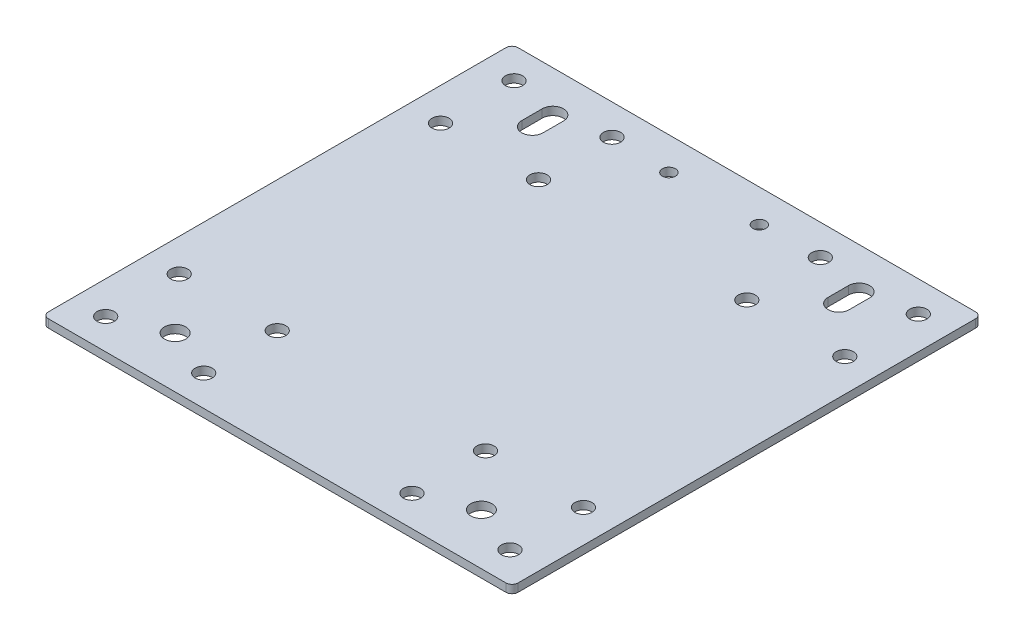
from build123d import *

# Parameters (mm, degrees)
SKETCH1_W           = 115
SKETCH1_H           = 115
SKETCH1_R           = 2.6
BOSS_EXTRUDE1_DEPTH = 2
SKETCH2_R           = 2.1
CUT_EXTRUDE1_DEPTH  = 82.341871137
SKETCH3_W           = 17.5
SKETCH3_H           = 22.5
CUT_EXTRUDE2_DEPTH  = 82.341871137
SKETCH4_R           = 1.6
CUT_EXTRUDE3_DEPTH  = 82.341871137
CUT_EXTRUDE4_DEPTH  = 82.341871137
SKETCH7_W           = 17.5
SKETCH7_H           = 22.5
BOSS_EXTRUDE2_DEPTH = 2
FILLET1_R           = 1.5


with BuildPart() as part:
    # Sketch1 → Boss-Extrude1 (new body)
    with BuildSketch(Plane(origin=(0, 0, 0), x_dir=(1, 0, 0), z_dir=(0, 1, 0))):
        Rectangle(SKETCH1_W, SKETCH1_H)
        with Locations(Location((-37.5, 45, 0), (0, 0, 270))):
            Circle(SKETCH1_R, mode=Mode.SUBTRACT)
        with Locations(Location((37.5, 45, 0), (0, 0, 90))):
            Circle(SKETCH1_R, mode=Mode.SUBTRACT)
        with Locations(Location((37.5, -45, 0), (0, 0, 270))):
            Circle(SKETCH1_R, mode=Mode.SUBTRACT)
        with Locations(Location((-37.5, -45, 0), (0, 0, 90))):
            Circle(SKETCH1_R, mode=Mode.SUBTRACT)
    extrude(amount=BOSS_EXTRUDE1_DEPTH)

    # Sketch2 → Cut-Extrude1 (cut, through all)
    with BuildSketch(Plane(origin=(0, 2, 0), x_dir=(1, 0, 0), z_dir=(0, 1, 0))):
        with Locations(Location((-49.5, -32, 0), (0, 0, 270))):
            Circle(SKETCH2_R)
        with Locations(Location((-25.5, -32, 0), (0, 0, 90))):
            Circle(SKETCH2_R)
        with Locations(Location((-25.5, -50, 0), (0, 0, 270))):
            Circle(SKETCH2_R)
        with Locations(Location((-49.5, -50, 0), (0, 0, 90))):
            Circle(SKETCH2_R)
        with Locations(Location((25.5, -50, 0), (0, 0, 90))):
            Circle(SKETCH2_R)
        with Locations(Location((49.5, -50, 0), (0, 0, 270))):
            Circle(SKETCH2_R)
        with Locations(Location((49.5, -32, 0), (0, 0, 90))):
            Circle(SKETCH2_R)
        with Locations(Location((25.5, -32, 0), (0, 0, 270))):
            Circle(SKETCH2_R)
        with Locations(Location((49.5, 50, 0), (0, 0, 90))):
            Circle(SKETCH2_R)
        with Locations(Location((49.5, 32, 0), (0, 0, 270))):
            Circle(SKETCH2_R)
        with Locations(Location((25.5, 50, 0), (0, 0, 270))):
            Circle(SKETCH2_R)
        with Locations(Location((25.5, 32, 0), (0, 0, 90))):
            Circle(SKETCH2_R)
        with Locations(Location((-25.5, 50, 0), (0, 0, 90))):
            Circle(SKETCH2_R)
        with Locations(Location((-49.5, 50, 0), (0, 0, 270))):
            Circle(SKETCH2_R)
        with Locations(Location((-49.5, 32, 0), (0, 0, 90))):
            Circle(SKETCH2_R)
        with Locations(Location((-25.5, 32, 0), (0, 0, 270))):
            Circle(SKETCH2_R)
    extrude(amount=-CUT_EXTRUDE1_DEPTH, mode=Mode.SUBTRACT)

    # Sketch3 → Cut-Extrude2 (cut, through all)
    with BuildSketch(Plane(origin=(0, 2, 0), x_dir=(1, 0, 0), z_dir=(0, 1, 0))):
        with Locations((0, -46.25)):
            Rectangle(SKETCH3_W, SKETCH3_H)
    extrude(amount=-CUT_EXTRUDE2_DEPTH, mode=Mode.SUBTRACT)

    # Sketch4 → Cut-Extrude3 (cut, through all)
    with BuildSketch(Plane(origin=(0, 2, 0), x_dir=(1, 0, 0), z_dir=(0, 1, 0))):
        with Locations(Location((-11.075, 49.5, 0), (0, 0, 270))):
            Circle(SKETCH4_R)
        with Locations(Location((11.075, 49.5, 0), (0, 0, 90))):
            Circle(SKETCH4_R)
    extrude(amount=-CUT_EXTRUDE3_DEPTH, mode=Mode.SUBTRACT)

    # Sketch6 → Cut-Extrude4 (cut, through all)
    with BuildSketch(Plane(origin=(0, 2, 0), x_dir=(1, 0, 0), z_dir=(0, 1, 0))):
        with BuildLine():
            Line((-34.9, 47.5), (-34.9, 42.5))
            ThreePointArc((-34.9, 42.5), (-37.5, 39.9), (-40.1, 42.5))
            Line((-40.1, 42.5), (-40.1, 47.5))
            ThreePointArc((-40.1, 47.5), (-37.5, 50.1), (-34.9, 47.5))
        make_face()
        with BuildLine():
            Line((34.9, 47.5), (34.9, 42.5))
            ThreePointArc((34.9, 42.5), (37.5, 39.9), (40.1, 42.5))
            Line((40.1, 42.5), (40.1, 47.5))
            ThreePointArc((40.1, 47.5), (37.5, 50.1), (34.9, 47.5))
        make_face()
    extrude(amount=-CUT_EXTRUDE4_DEPTH, mode=Mode.SUBTRACT)

    # Sketch7 → Boss-Extrude2 (add, through all)
    with BuildSketch(Plane(origin=(0, 2, 0), x_dir=(1, 0, 0), z_dir=(0, 1, 0))):
        with Locations((0, -46.25)):
            Rectangle(SKETCH7_W, SKETCH7_H)
    extrude(amount=-BOSS_EXTRUDE2_DEPTH)

    # Fillet1
    fillet1_edges = [part.edges().sort_by_distance(p)[0] for p in [
        (57.5, 1, 57.5),
        (-57.5, 1, 57.5),
        (-57.5, 1, -57.5),
        (57.5, 1, -57.5),
    ]]
    fillet(fillet1_edges, radius=FILLET1_R)


solid = part.part
